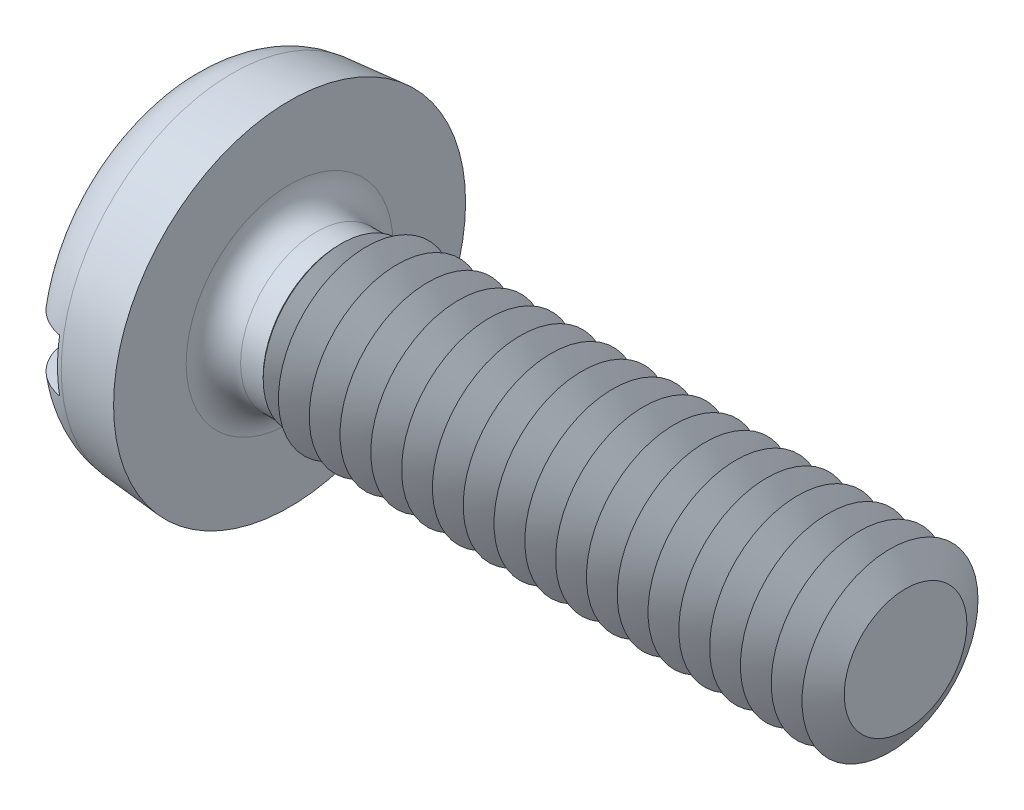
from build123d import *

# Parameters (mm, degrees)
SKETCH_4_W             = 1
SKETCH_4_H             = 1.2
CUT_EXTRUDE_1_DEPTH    = 50
PATTERN_LINEAR_1_COUNT = 19
PATTERN_LINEAR_1_PITCH = 0.7


with BuildPart() as part:
    # 草图3 → Revolve 915 (revolve)
    with BuildSketch(Plane.XY, mode=Mode.PRIVATE) as revolve_915_sk:
        with BuildLine():
            Line((0, 0), (16.4, 0))
            Line((16.4, 0), (16.4, 2))
            Line((16.4, 2), (3.8, 2))
            Line((3.8, 2), (3.532, 1.732))
            Line((3.532, 1.732), (3.018, 1.732))
            ThreePointArc((3.018, 1.732), (2.581008009, 1.913008009), (2.4, 2.35))
            Line((2.4, 2.35), (2.4, 4))
            Line((2.4, 4), (1.095413109, 3.885863436))
            ThreePointArc((1.095413109, 3.885863436), (0.315267196, 3.501138048), (0, 2.690429799))
            Line((0, 2.690429799), (0, 0))
        make_face()
    revolve(revolve_915_sk.sketch.rotate(Axis((-2.477021524, 0, 0), (1, 0, 0)), 90), axis=Axis((-2.477021524, 0, 0), (1, 0, 0)))

    # 草图4 → 切除-拉伸1 (cut, symmetric)
    with BuildSketch(Plane.XY):
        with Locations((0.5, 0)):
            Rectangle(SKETCH_4_W, SKETCH_4_H)
    extrude(amount=CUT_EXTRUDE_1_DEPTH, both=True, mode=Mode.SUBTRACT)

    # 草图5 → 切除-旋转1 (revolve, cut)
    with BuildSketch(Plane.XY, mode=Mode.PRIVATE) as cut_revolve_1_sk:
        Polygon((16.046208796, 2), (16.746208796, 2), (16.4, 1.3938), align=None)
    cut_revolve_1 = revolve(cut_revolve_1_sk.sketch.rotate(Axis((6.174994867, 0, 0), (-1, 0, 0)), 270), axis=Axis((6.174994867, 0, 0), (-1, 0, 0)), mode=Mode.SUBTRACT)

    # 阵列(线性)1: 切除-旋转1 ×19
    with Locations(*[(-i * PATTERN_LINEAR_1_PITCH, 0, 0) for i in range(1, PATTERN_LINEAR_1_COUNT)]):
        add(cut_revolve_1, mode=Mode.SUBTRACT)


solid = part.part
